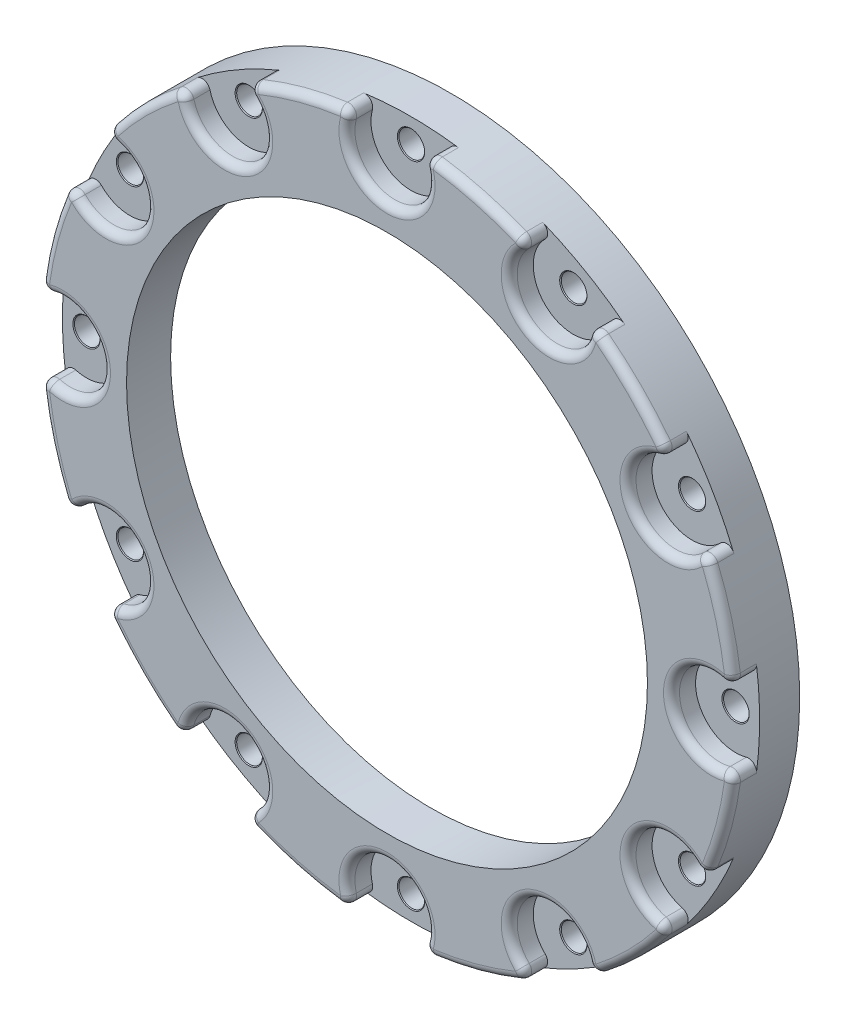
from build123d import *

# Parameters (mm, degrees)
SKETCH1_R           = 43.5
SKETCH1_R_2         = 32.5
BOSS_EXTRUDE1_DEPTH = 8
SKETCH2_R           = 37.7
CUT_EXTRUDE1_DEPTH  = 2.5
SKETCH4_R           = 1.6
CUT_EXTRUDE3_DEPTH  = 63.036279708
SKETCH5_R           = 1.6
CUT_EXTRUDE4_DEPTH  = 3
FILLET1_R           = 1
CHAMFER1_SIZE       = 0.1
FILLET2_R           = 0.5


with BuildPart() as part:
    # Sketch1 → Boss-Extrude1 (new body)
    with BuildSketch(Plane.XY):
        Circle(SKETCH1_R)
        Circle(SKETCH1_R_2, mode=Mode.SUBTRACT)
    extrude(amount=BOSS_EXTRUDE1_DEPTH)

    # Sketch2 → Cut-Extrude1 (cut)
    with BuildSketch(Plane(origin=(0, 0, 0), x_dir=(-1, 0, 0), z_dir=(0, 0, -1))):
        Circle(SKETCH2_R)
    extrude(amount=-CUT_EXTRUDE1_DEPTH, mode=Mode.SUBTRACT)

    # Sketch4 → Cut-Extrude3 (cut, through all)
    with BuildSketch(Plane.XY.offset(8)):
        with Locations((-40.5, 0)):
            Circle(SKETCH4_R)
        with Locations((-35.074028853, 20.25)):
            Circle(SKETCH4_R)
        with Locations((-20.25, 35.074028853)):
            Circle(SKETCH4_R)
        with Locations((0, 40.5)):
            Circle(SKETCH4_R)
        with Locations((20.25, 35.074028853)):
            Circle(SKETCH4_R)
        with Locations((35.074028853, 20.25)):
            Circle(SKETCH4_R)
        with Locations((40.5, 0)):
            Circle(SKETCH4_R)
        with Locations((35.074028853, -20.25)):
            Circle(SKETCH4_R)
        with Locations((20.25, -35.074028853)):
            Circle(SKETCH4_R)
        with Locations((0, -40.5)):
            Circle(SKETCH4_R)
        with Locations((-20.25, -35.074028853)):
            Circle(SKETCH4_R)
        with Locations((-35.074028853, -20.25)):
            Circle(SKETCH4_R)
    extrude(amount=-CUT_EXTRUDE3_DEPTH, mode=Mode.SUBTRACT)

    # Sketch5 → Cut-Extrude4 (cut)
    # profile 1 of 12: a face of its own
    with BuildSketch(Plane.XY.offset(8)):
        with BuildLine():
            ThreePointArc((-5.917396399, 43.095642702), (-5.028394161, 42.76299296), (-4.817803582, 41.83744856))
            ThreePointArc((-4.817803582, 41.83744856), (0, 35.5), (4.817803582, 41.83744856))
            ThreePointArc((4.817803582, 41.83744856), (5.028394161, 42.76299296), (5.917396399, 43.095642702))
            ThreePointArc((5.917396399, 43.095642702), (0, 43.5), (-5.917396399, 43.095642702))
        make_face()
        with Locations((0, 40.5)):
            Circle(SKETCH5_R, mode=Mode.SUBTRACT)
    # profile 2 of 12: a face of its own
    with BuildSketch(Plane.XY.offset(8)):
        with BuildLine():
            ThreePointArc((-16.746383988, 38.641195073), (-17.026779396, 39.548035326), (-16.423205745, 40.280619571))
            ThreePointArc((-16.423205745, 40.280619571), (-21.75, 37.672105065), (-26.672436957, 34.363223172))
            ThreePointArc((-26.672436957, 34.363223172), (-25.736213564, 34.519641165), (-25.091064572, 33.823391491))
            ThreePointArc((-25.091064572, 33.823391491), (-17.75, 30.743901834), (-16.746383988, 38.641195073))
        make_face()
        with Locations((-20.25, 35.074028853)):
            Circle(SKETCH5_R, mode=Mode.SUBTRACT)
    # profile 3 of 12: a face of its own
    with BuildSketch(Plane.XY.offset(8)):
        with BuildLine():
            ThreePointArc((26.672436957, 34.363223172), (21.75, 37.672105065), (16.423205745, 40.280619571))
            ThreePointArc((16.423205745, 40.280619571), (17.026779396, 39.548035326), (16.746383988, 38.641195073))
            ThreePointArc((16.746383988, 38.641195073), (17.75, 30.743901834), (25.091064572, 33.823391491))
            ThreePointArc((25.091064572, 33.823391491), (25.736213564, 34.519641165), (26.672436957, 34.363223172))
        make_face()
        with Locations((20.25, 35.074028853)):
            Circle(SKETCH5_R, mode=Mode.SUBTRACT)
    # profile 4 of 12: a face of its own
    with BuildSketch(Plane.XY.offset(8)):
        with BuildLine():
            ThreePointArc((-33.823391491, 25.091064572), (-34.519641165, 25.736213564), (-34.363223172, 26.672436957))
            ThreePointArc((-34.363223172, 26.672436957), (-37.672105065, 21.75), (-40.280619571, 16.423205745))
            ThreePointArc((-40.280619571, 16.423205745), (-39.548035326, 17.026779396), (-38.641195073, 16.746383988))
            ThreePointArc((-38.641195073, 16.746383988), (-30.743901834, 17.75), (-33.823391491, 25.091064572))
        make_face()
        with Locations((-35.074028853, 20.25)):
            Circle(SKETCH5_R, mode=Mode.SUBTRACT)
    # profile 5 of 12: a face of its own
    with BuildSketch(Plane.XY.offset(8)):
        with BuildLine():
            ThreePointArc((40.280619571, 16.423205745), (37.672105065, 21.75), (34.363223172, 26.672436957))
            ThreePointArc((34.363223172, 26.672436957), (34.519641165, 25.736213564), (33.823391491, 25.091064572))
            ThreePointArc((33.823391491, 25.091064572), (30.743901834, 17.75), (38.641195073, 16.746383988))
            ThreePointArc((38.641195073, 16.746383988), (39.548035326, 17.026779396), (40.280619571, 16.423205745))
        make_face()
        with Locations((35.074028853, 20.25)):
            Circle(SKETCH5_R, mode=Mode.SUBTRACT)
    # profile 6 of 12: a face of its own
    with BuildSketch(Plane.XY.offset(8)):
        with BuildLine():
            ThreePointArc((-41.83744856, 4.817803582), (-42.76299296, 5.028394161), (-43.095642702, 5.917396399))
            ThreePointArc((-43.095642702, 5.917396399), (-43.5, 0), (-43.095642702, -5.917396399))
            ThreePointArc((-43.095642702, -5.917396399), (-42.76299296, -5.028394161), (-41.83744856, -4.817803582))
            ThreePointArc((-41.83744856, -4.817803582), (-35.5, 0), (-41.83744856, 4.817803582))
        make_face()
        with Locations((-40.5, 0)):
            Circle(SKETCH5_R, mode=Mode.SUBTRACT)
    # profile 7 of 12: a face of its own
    with BuildSketch(Plane.XY.offset(8)):
        with BuildLine():
            ThreePointArc((43.095642702, -5.917396399), (43.5, 0), (43.095642702, 5.917396399))
            ThreePointArc((43.095642702, 5.917396399), (42.76299296, 5.028394161), (41.83744856, 4.817803582))
            ThreePointArc((41.83744856, 4.817803582), (35.5, 0), (41.83744856, -4.817803582))
            ThreePointArc((41.83744856, -4.817803582), (42.76299296, -5.028394161), (43.095642702, -5.917396399))
        make_face()
        with Locations((40.5, 0)):
            Circle(SKETCH5_R, mode=Mode.SUBTRACT)
    # profile 8 of 12: a face of its own
    with BuildSketch(Plane.XY.offset(8)):
        with BuildLine():
            ThreePointArc((-38.641195073, -16.746383988), (-39.548035326, -17.026779396), (-40.280619571, -16.423205745))
            ThreePointArc((-40.280619571, -16.423205745), (-37.672105065, -21.75), (-34.363223172, -26.672436957))
            ThreePointArc((-34.363223172, -26.672436957), (-34.519641165, -25.736213564), (-33.823391491, -25.091064572))
            ThreePointArc((-33.823391491, -25.091064572), (-30.743901834, -17.75), (-38.641195073, -16.746383988))
        make_face()
        with Locations((-35.074028853, -20.25)):
            Circle(SKETCH5_R, mode=Mode.SUBTRACT)
    # profile 9 of 12: a face of its own
    with BuildSketch(Plane.XY.offset(8)):
        with BuildLine():
            ThreePointArc((34.363223172, -26.672436957), (37.672105065, -21.75), (40.280619571, -16.423205745))
            ThreePointArc((40.280619571, -16.423205745), (39.548035326, -17.026779396), (38.641195073, -16.746383988))
            ThreePointArc((38.641195073, -16.746383988), (30.743901834, -17.75), (33.823391491, -25.091064572))
            ThreePointArc((33.823391491, -25.091064572), (34.519641165, -25.736213564), (34.363223172, -26.672436957))
        make_face()
        with Locations((35.074028853, -20.25)):
            Circle(SKETCH5_R, mode=Mode.SUBTRACT)
    # profile 10 of 12: a face of its own
    with BuildSketch(Plane.XY.offset(8)):
        with BuildLine():
            ThreePointArc((-25.091064572, -33.823391491), (-25.736213564, -34.519641165), (-26.672436957, -34.363223172))
            ThreePointArc((-26.672436957, -34.363223172), (-21.75, -37.672105065), (-16.423205745, -40.280619571))
            ThreePointArc((-16.423205745, -40.280619571), (-17.026779396, -39.548035326), (-16.746383988, -38.641195073))
            ThreePointArc((-16.746383988, -38.641195073), (-17.75, -30.743901834), (-25.091064572, -33.823391491))
        make_face()
        with Locations((-20.25, -35.074028853)):
            Circle(SKETCH5_R, mode=Mode.SUBTRACT)
    # profile 11 of 12: a face of its own
    with BuildSketch(Plane.XY.offset(8)):
        with BuildLine():
            ThreePointArc((16.423205745, -40.280619571), (21.75, -37.672105065), (26.672436957, -34.363223172))
            ThreePointArc((26.672436957, -34.363223172), (25.736213564, -34.519641165), (25.091064572, -33.823391491))
            ThreePointArc((25.091064572, -33.823391491), (17.75, -30.743901834), (16.746383988, -38.641195073))
            ThreePointArc((16.746383988, -38.641195073), (17.026779396, -39.548035326), (16.423205745, -40.280619571))
        make_face()
        with Locations((20.25, -35.074028853)):
            Circle(SKETCH5_R, mode=Mode.SUBTRACT)
    # profile 12 of 12: a face of its own
    with BuildSketch(Plane.XY.offset(8)):
        with BuildLine():
            ThreePointArc((-4.817803582, -41.83744856), (-5.028394161, -42.76299296), (-5.917396399, -43.095642702))
            ThreePointArc((-5.917396399, -43.095642702), (0, -43.5), (5.917396399, -43.095642702))
            ThreePointArc((5.917396399, -43.095642702), (5.028394161, -42.76299296), (4.817803582, -41.83744856))
            ThreePointArc((4.817803582, -41.83744856), (0, -35.5), (-4.817803582, -41.83744856))
        make_face()
        with Locations((0, -40.5)):
            Circle(SKETCH5_R, mode=Mode.SUBTRACT)
    extrude(amount=-CUT_EXTRUDE4_DEPTH, mode=Mode.SUBTRACT)

    # Fillet1
    fillet1_edges = [part.edges().sort_by_distance(p)[0] for p in [
        (17.026779396, 39.548035326, 8),
        (11.258628462, 42.017773444, 8),
        (5.028394161, 42.76299296, 8),
        (0, 35.5, 8),
        (-5.028394161, 42.76299296, 8),
        (-11.258628462, 42.017773444, 8),
        (-17.026779396, 39.548035326, 8),
        (-17.75, 30.743901834, 8),
        (-25.736213564, 34.519641165, 8),
        (-30.759144982, 30.759144982, 8),
        (-34.519641165, 25.736213564, 8),
        (-30.743901834, 17.75, 8),
        (-39.548035326, 17.026779396, 8),
        (-42.017773444, 11.258628462, 8),
        (-42.76299296, 5.028394161, 8),
        (-35.5, 0, 8),
        (-42.76299296, -5.028394161, 8),
        (-42.017773444, -11.258628462, 8),
        (-39.548035326, -17.026779396, 8),
        (-30.743901834, -17.75, 8),
        (-34.519641165, -25.736213564, 8),
        (-30.759144982, -30.759144982, 8),
        (-25.736213564, -34.519641165, 8),
        (-17.75, -30.743901834, 8),
        (-17.026779396, -39.548035326, 8),
        (-11.258628462, -42.017773444, 8),
        (-5.028394161, -42.76299296, 8),
        (0, -35.5, 8),
        (5.028394161, -42.76299296, 8),
        (11.258628462, -42.017773444, 8),
        (17.026779396, -39.548035326, 8),
        (17.75, -30.743901834, 8),
        (25.736213564, -34.519641165, 8),
        (30.759144982, -30.759144982, 8),
        (34.519641165, -25.736213564, 8),
        (30.743901834, -17.75, 8),
        (39.548035326, -17.026779396, 8),
        (42.017773444, -11.258628462, 8),
        (42.76299296, -5.028394161, 8),
        (35.5, 0, 8),
        (42.76299296, 5.028394161, 8),
        (42.017773444, 11.258628462, 8),
        (39.548035326, 17.026779396, 8),
        (30.743901834, 17.75, 8),
        (34.519641165, 25.736213564, 8),
        (30.759144982, 30.759144982, 8),
        (25.736213564, 34.519641165, 8),
        (17.75, 30.743901834, 8),
    ]]
    fillet(fillet1_edges, radius=FILLET1_R)

    # Chamfer1
    chamfer1_edges = [part.edges().sort_by_distance(p)[0] for p in [
        (-36.674028853, 20.25, 5),
        (-21.85, 35.074028853, 5),
        (-1.6, 40.5, 5),
        (18.65, 35.074028853, 5),
        (33.474028853, 20.25, 5),
        (38.9, 0, 5),
        (33.474028853, -20.25, 5),
        (18.65, -35.074028853, 5),
        (-1.6, -40.5, 5),
        (-21.85, -35.074028853, 5),
        (-36.674028853, -20.25, 5),
        (-42.1, 0, 5),
    ]]
    chamfer(chamfer1_edges, length=CHAMFER1_SIZE)

    # Fillet2
    fillet2_edges = [part.edges().sort_by_distance(p)[0] for p in [
        (37.7, 0, 2.5),
    ]]
    fillet(fillet2_edges, radius=FILLET2_R)


solid = part.part
